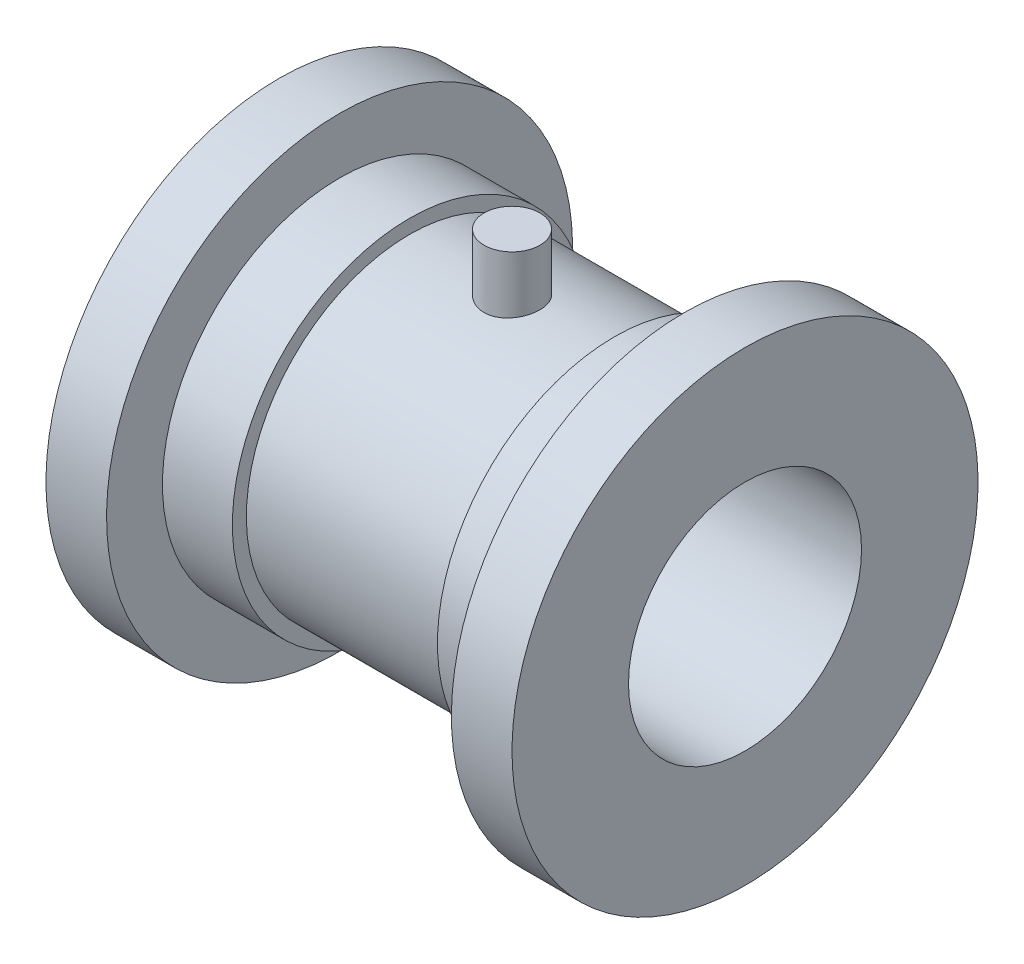
from build123d import *

# Parameters (mm, degrees)
SKETCH2_R           = 2
CUT_EXTRUDE1_DEPTH  = 42
SKETCH3_R           = 3
BOSS_EXTRUDE1_DEPTH = 23.5
SKETCH20_R          = 12.5
CUT_EXTRUDE2_DEPTH  = 62.237243651


with BuildPart() as part:
    # Sketch1 → Revolve1 (revolve)
    with BuildSketch(Plane.XY):
        Polygon((25, 25), (25, 12.5), (-25, 12.5), (-25, 25), (-18.5, 25), (-18.5, 19), (-11, 19), (-11, 17.5), (11, 17.5), (11, 19), (18.5, 19), (18.5, 25), align=None)
    revolve(axis=Axis((25, 0, 0), (-1, 0, 0)))

    # Sketch2 → Cut-Extrude1 (cut)
    with BuildSketch(Plane(origin=(0, 0, 0), x_dir=(1, 0, 0), z_dir=(0, 1, 0))):
        with Locations(Location((0, 0, 0), (0, 0, 270))):
            Circle(SKETCH2_R)
    extrude(amount=-CUT_EXTRUDE1_DEPTH, mode=Mode.SUBTRACT)

    # Sketch3 → Boss-Extrude1 (add)
    with BuildSketch(Plane(origin=(0, 0, 0), x_dir=(1, 0, 0), z_dir=(0, 1, 0))):
        with Locations(Location((0, 0, 0), (0, 0, 180))):
            Circle(SKETCH3_R)
    extrude(amount=BOSS_EXTRUDE1_DEPTH)

    # Sketch20 → Cut-Extrude2 (cut, through all)
    with BuildSketch(Plane.ZY.offset(25)):
        with Locations(Location((0, 0, 0), (0, 0, 90))):
            Circle(SKETCH20_R)
    extrude(amount=-CUT_EXTRUDE2_DEPTH, mode=Mode.SUBTRACT)


solid = part.part
